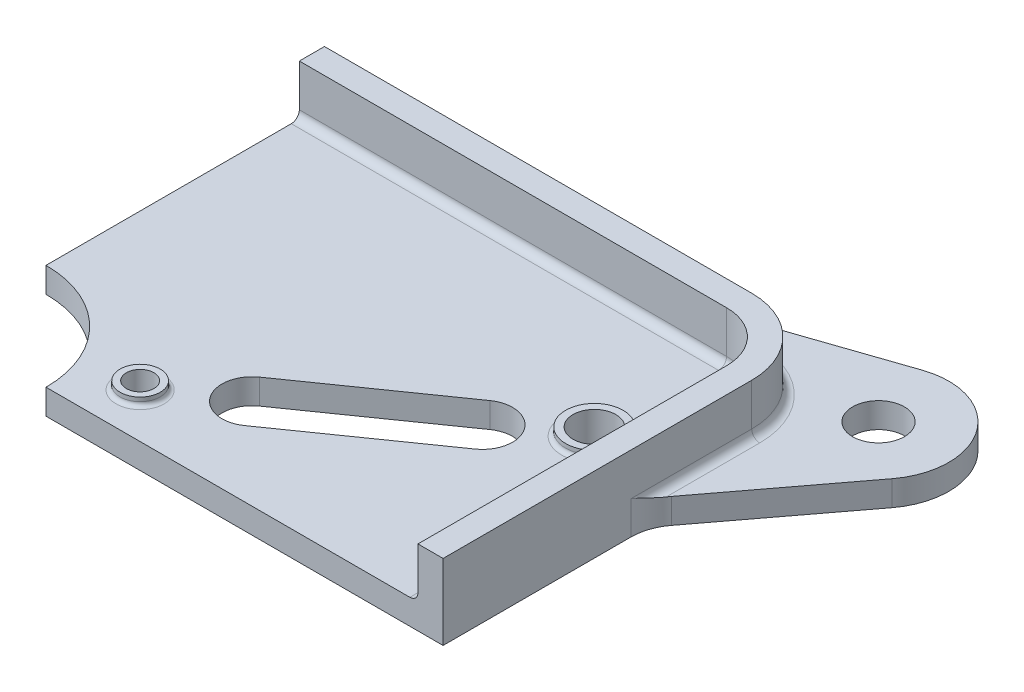
from build123d import *

# Parameters (mm, degrees)
EXTRUDE1_DEPTH = 9.525
SHELL1_T       = -3.175
SKETCH4_R      = 3.2729084122023364
EXTRUDE2_DEPTH = 3.175
FILLET1_R      = 6.35
FILLET2_R      = 1.016
EXTRUDE3_REACH = 99.642
SKETCH5_R      = 3.633554116992031
SKETCH5_R_2    = 2.5400000000000023
SKETCH6_R      = 2.7088319516261428
SKETCH6_R_2    = 1.739899999999999
EXTRUDE4_DEPTH = 98.64160513278141
FILLET3_R      = 0.508


with BuildPart() as part:
    # Sketch1 → Extrude1 (new body)
    with BuildSketch(Plane(origin=(0, 0, 0), x_dir=(1, 0, 0), z_dir=(0, 1, 0))):
        with BuildLine():
            Line((13.334999999999999, 0), (63.5, 0))
            Line((63.5, 0), (63.5, 38.988999999999926))
            ThreePointArc((63.5, 38.988999999999926), (60.71019209080187, 45.724192090801864), (53.97499999999993, 48.513999999999996))
            Line((53.97499999999993, 48.513999999999996), (0, 48.513999999999996))
            Line((0, 48.513999999999996), (0, 13.334999999999999))
            ThreePointArc((0, 13.334999999999999), (9.429268927122612, 9.42926892712261), (13.334999999999999, 0))
        make_face()
        with BuildLine():
            Line((25.717261934170715, 14.596576467420496), (42.82641557504918, 26.576534819151746))
            ThreePointArc((42.82641557504918, 26.576534819151746), (48.13271108628772, 25.640891752908175), (47.19706802004417, 20.334596241669633))
            Line((47.19706802004417, 20.334596241669633), (30.087914379165696, 8.354637889938386))
            ThreePointArc((30.087914379165696, 8.354637889938386), (24.78161886792715, 9.29028095618195), (25.717261934170715, 14.596576467420496))
        make_face(mode=Mode.SUBTRACT)
    extrude(amount=EXTRUDE1_DEPTH)

    # Shell1
    shell1_openings = [part.faces().sort_by_distance(p)[0] for p in [
        (38.4175, 4.7625, 0),
        (9.429268927, 4.7625, -9.429268927),
        (0, 4.7625, -30.9245),
        (32.524178478, 9.525, -25.566315858),
        (24.781618868, 4.7625, -9.290280956),
        (38.6424912, 4.7625, -14.344617066),
        (48.132711086, 4.7625, -25.640891753),
        (34.271838755, 4.7625, -20.586555643),
    ]]
    offset(amount=SHELL1_T, openings=shell1_openings, kind=Kind.INTERSECTION)

    # Sketch4 → Extrude2 (add)
    with BuildSketch(Plane(origin=(0, 0, 0), x_dir=(1, 0, 0), z_dir=(0, 1, 0))):
        with BuildLine():
            Line((41.325799999999994, 48.513999999999996), (66.82999351166346, 57.21904298473958))
            ThreePointArc((66.82999351166346, 57.21904298473958), (76.90463826764335, 54.01609142946003), (76.79370933191484, 43.445137811366784))
            Line((76.79370933191484, 43.445137811366784), (63.5, 25.8572))
            Line((63.5, 25.8572), (63.5, 38.988999999999926))
            ThreePointArc((63.5, 38.988999999999926), (60.71019209080187, 45.724192090801864), (53.97499999999993, 48.513999999999996))
            Line((53.97499999999993, 48.513999999999996), (41.325799999999994, 48.513999999999996))
        make_face()
        with Locations(Location((69.70164744855023, 48.8056189691106, 0), (0, 0, 270))):
            Circle(SKETCH4_R, mode=Mode.SUBTRACT)
    extrude(amount=EXTRUDE2_DEPTH)

    # Fillet1
    fillet1_edges = [part.edges().sort_by_distance(p)[0] for p in [
        (41.325799999999994, 1.5875, -48.513999999999996),
        (63.5, 1.5875, -25.8572),
    ]]
    fillet(fillet1_edges, radius=FILLET1_R)

    # Fillet2
    fillet2_edges = [part.edges().sort_by_distance(p)[0] for p in [
        (47.12348109415911, 3.175, -48.513999999999996),
        (26.987500000000004, 3.175, -45.339),
        (58.46512806053458, 3.175, -43.47912806053458),
        (60.325, 3.175, -19.494500000000002),
        (60.71019209080187, 3.175, -45.724192090801864),
        (63.5, 3.175, -31.358185610352162),
    ]]
    fillet(fillet2_edges, radius=FILLET2_R)

    # Sketch5 → Extrude3 (add, up to next)
    with BuildSketch(Plane(origin=(0, 4.191000000000001, 0), x_dir=(-1, 0, 0), z_dir=(0, 1, 0)), mode=Mode.PRIVATE) as extrude3_sk1:
        with Locations(Location((-53.334326567522815, -29.283102123737322, 0), (0, 0, 90))):
            Circle(SKETCH5_R)
    extrude3_tool1 = extrude(extrude3_sk1.sketch, amount=-EXTRUDE3_REACH, mode=Mode.PRIVATE) - part.part
    # Sketch5 → Extrude3 (add, up to next)
    with BuildSketch(Plane(origin=(0, 4.191000000000001, 0), x_dir=(-1, 0, 0), z_dir=(0, 1, 0)), mode=Mode.PRIVATE) as extrude3_sk2:
        with Locations(Location((-19.58000338669206, -5.648070585352799, 0), (0, 0, 90))):
            Circle(SKETCH5_R_2)
    extrude3_tool2 = extrude(extrude3_sk2.sketch, amount=-EXTRUDE3_REACH, mode=Mode.PRIVATE) - part.part
    add(extrude3_tool1.solids().sort_by_distance((53.334327, 4.191, -29.283102))[0])
    add(extrude3_tool2.solids().sort_by_distance((19.580003, 4.191, -5.648071))[0])

    # Sketch6 → Extrude4 (cut, through all)
    with BuildSketch(Plane(origin=(0, 4.191000000000001, 0), x_dir=(-1, 0, 0), z_dir=(0, 1, 0))):
        with Locations(Location((-53.334326567522815, -29.283102123737322, 0), (0, 0, 90))):
            Circle(SKETCH6_R)
        with Locations(Location((-19.58000338669206, -5.648070585352799, 0), (0, 0, 90))):
            Circle(SKETCH6_R_2)
    extrude(amount=-EXTRUDE4_DEPTH, mode=Mode.SUBTRACT)

    # Fillet3
    fillet3_edges = [part.edges().sort_by_distance(p)[0] for p in [
        (19.58000338669206, 3.175, -8.1880705853528),
        (53.334326567522815, 3.175, -32.91665624072935),
    ]]
    fillet(fillet3_edges, radius=FILLET3_R)


solid = part.part
